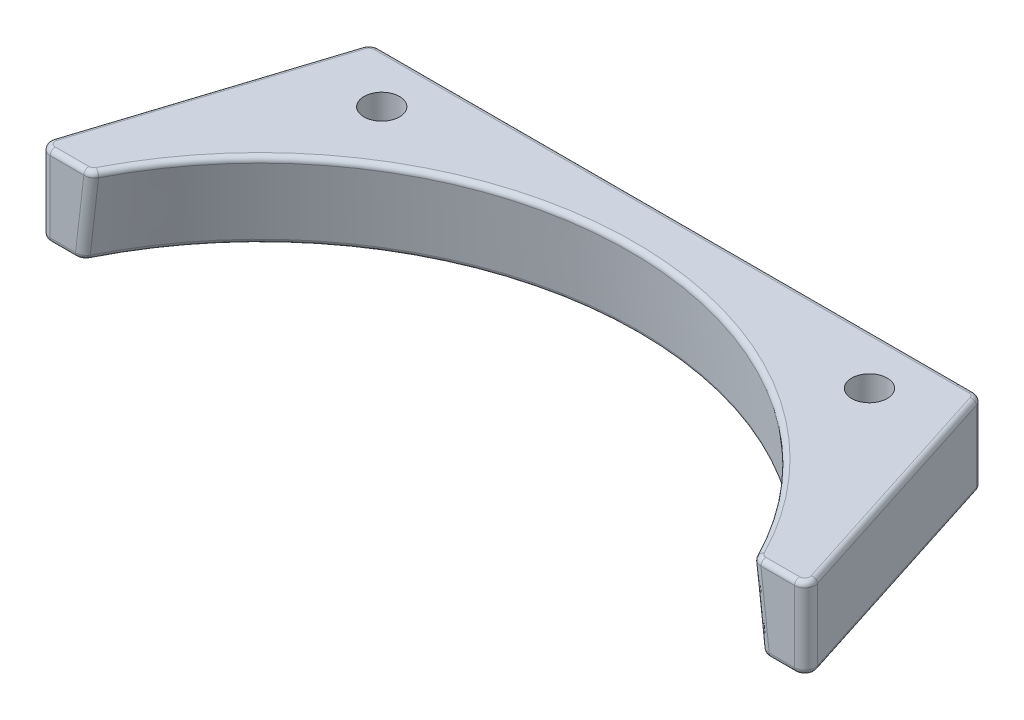
from build123d import *

# Parameters (mm, degrees)
BOSS_EXTRU_1_START      = 35
BOSS_EXTRU_1_DEPTH      = 8
CONG_1_R                = 1
ESQUISSE3_R             = 1.75
ENL_V_MAT_EXTRU_1_DEPTH = 56.497932403
ESQUISSE4_R             = 3.5
ENL_V_MAT_EXTRU_2_DEPTH = 3.5
CONG_2_R                = 0.5


with BuildPart() as part:
    # Esquisse1 → Boss.-Extru.1 (new body)
    with BuildSketch(Plane(origin=(0, 0, 0), x_dir=(1, 0, 0), z_dir=(0, 1, 0)).offset(BOSS_EXTRU_1_START)):
        Polygon((0, 40), (30, 40), (38, 15), (0, 15), align=None)
    extrude(amount=-BOSS_EXTRU_1_DEPTH)

    # Esquisse2 → Enlèvement de matière-Révolution1 (revolve, cut)
    with BuildSketch(Plane(origin=(0, 0, 0), x_dir=(0, 0, -1), z_dir=(1, 0, 0))):
        Polygon((39, 0), (27, 115), (-1, 115), (-1, 0), align=None)
    revolve(axis=Axis((0, 115, 1), (0, 1, 0)), mode=Mode.SUBTRACT)

    # Congé1
    cong_1_edges = [part.edges().sort_by_distance(p)[0] for p in [
        (33.101067508, 31.000070332, -15),
        (30, 31, -40),
        (38, 31, -15),
    ]]
    fillet(cong_1_edges, radius=CONG_1_R)

    # Esquisse3 → Enlèv. mat.-Extru.1 (cut, through all)
    with BuildSketch(Plane.XZ.offset(-27)):
        with Locations(Location((24, -35, 0), (0, 0, 270))):
            Circle(ESQUISSE3_R)
    extrude(amount=-ENL_V_MAT_EXTRU_1_DEPTH, mode=Mode.SUBTRACT)

    # Esquisse4 → Enlèv. mat.-Extru.2 (cut)
    with BuildSketch(Plane.XZ.offset(-27)):
        with Locations(Location((24, -35, 0), (0, 0, 270))):
            Circle(ESQUISSE4_R)
    extrude(amount=-ENL_V_MAT_EXTRU_2_DEPTH, mode=Mode.SUBTRACT)

    # Congé2
    cong_2_edges = [part.edges().sort_by_distance(p)[0] for p in [
        (37.437752927, 27, -15.410413589),
        (33.902471767, 27, -27.804775727),
        (29.859634031, 27, -39.807705307),
        (33.664775152, 27, -15.150178589),
        (14.63502381, 35, -40),
        (29.859634031, 35, -39.807705307),
        (33.902471767, 35, -27.804775727),
        (37.437752927, 35, -15.410413589),
        (34.945309997, 35, -15),
        (32.73463145, 35, -15.147278852),
        (14.63502381, 27, -40),
        (19.582003838, 27, -30.60840893),
        (18.969834976, 35, -30.00499673),
        (35.412730047, 27, -15),
    ]]
    fillet(cong_2_edges, radius=CONG_2_R)

    # Symétrie1: part across plane


with BuildPart() as part_1:
    add(part.part)
    add(part.part.mirror(Plane(origin=(0, 27, -40), x_dir=(0, 0, 1), z_dir=(-1, 0, 0))))


solid = part_1.part
